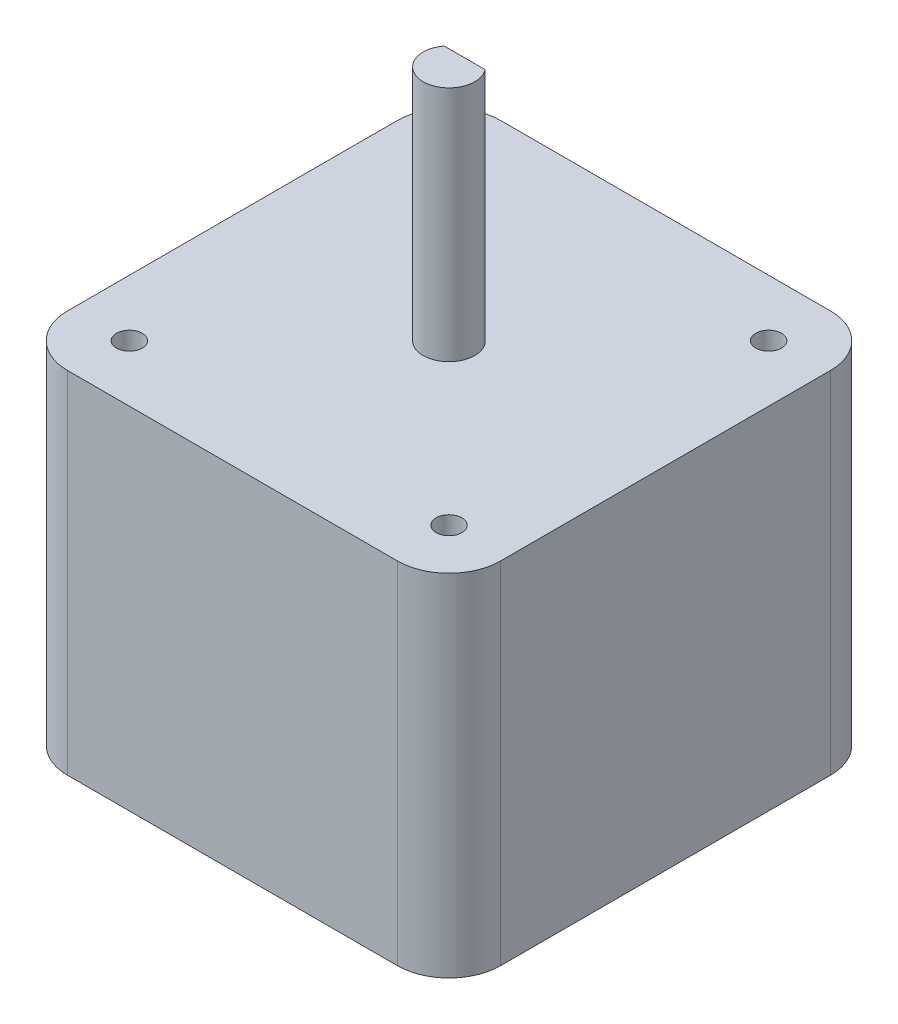
from build123d import *

# Parameters (mm, degrees)
SKETCH_1_W             = 42
SKETCH_1_H             = 42
EXTRUDE_1_DEPTH        = 34
HOLE_WIZARD_M3_1_D     = 2.5
HOLE_WIZARD_M3_1_DEPTH = 5
HOLE_WIZARD_M3_1_TIP   = 0.751075774
EXTRUDE_2_DEPTH        = 23
FILLET_1_R             = 5


with BuildPart() as part:
    # 草图1 → 凸台-拉伸1 (new body)
    with BuildSketch(Plane(origin=(0, 0, 0), x_dir=(1, 0, 0), z_dir=(0, 1, 0))):
        Rectangle(SKETCH_1_W, SKETCH_1_H)
    extrude(amount=EXTRUDE_1_DEPTH)

    # M3 螺纹孔1
    with Locations(Plane(origin=(0, 34, 0), x_dir=(1, 0, 0), z_dir=(0, 1, 0))):
        with Locations((-15.5, 15.5), (15.5, -15.5), (-15.5, -15.5), (15.5, 15.5)):
            Hole(HOLE_WIZARD_M3_1_D / 2, depth=HOLE_WIZARD_M3_1_DEPTH)
            with Locations((0, 0, -(HOLE_WIZARD_M3_1_DEPTH + HOLE_WIZARD_M3_1_TIP / 2))):  # 118° drill point
                Cone(0, HOLE_WIZARD_M3_1_D / 2, HOLE_WIZARD_M3_1_TIP, mode=Mode.SUBTRACT)

    # 草图5 → 凸台-拉伸2 (add)
    with BuildSketch(Plane(origin=(0, 34, 0), x_dir=(1, 0, 0), z_dir=(0, 1, 0))):
        with BuildLine():
            Line((1.984567922, 1.520358564), (-1.984567922, 1.520358564))
            ThreePointArc((-1.984567922, 1.520358564), (-0.802676832, -2.367638043), (2.5, 0))
            ThreePointArc((2.5, 0), (2.367638043, 0.802676832), (1.984567922, 1.520358564))
        make_face()
    extrude(amount=EXTRUDE_2_DEPTH)

    # 圆角1
    fillet_1_edges = [part.edges().sort_by_distance(p)[0] for p in [
        (21, 17, 21),
        (-21, 17, 21),
        (-21, 17, -21),
        (21, 17, -21),
    ]]
    fillet(fillet_1_edges, radius=FILLET_1_R)


solid = part.part
